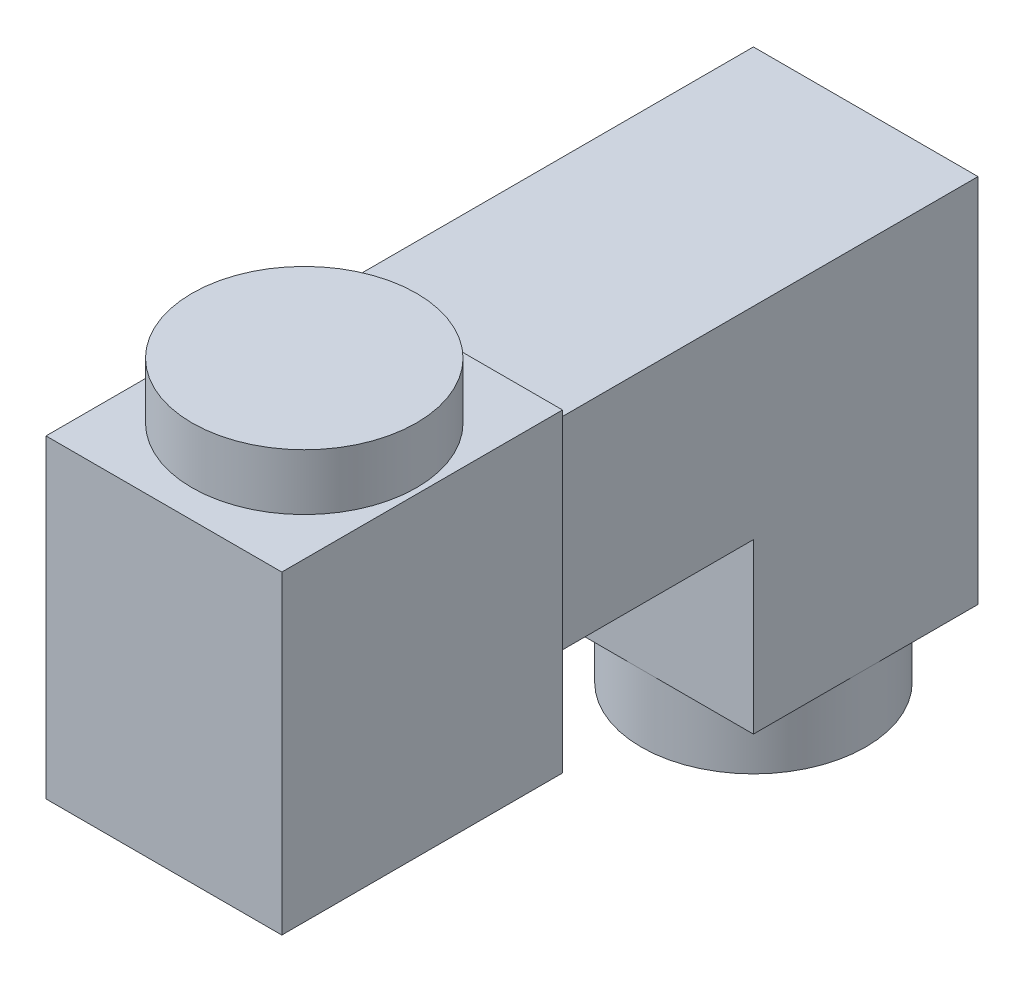
from build123d import *

# Parameters (mm, degrees)
ESQUISSE1_W        = 25
ESQUISSE1_H        = 28
BOSS_EXTRU_1_DEPTH = 21
ESQUISSE2_W        = 20
ESQUISSE2_H        = 18
BOSS_EXTRU_2_DEPTH = 37.5
ESQUISSE3_W        = 20
ESQUISSE3_H        = 20
BOSS_EXTRU_3_DEPTH = 15
ESQUISSE5_R        = 10
BOSS_EXTRU_4_DEPTH = 5
ESQUISSE6_R        = 10
BOSS_EXTRU_5_DEPTH = 6


with BuildPart() as part:
    # Esquisse1 → Boss.-Extru.1 (new body)
    with BuildSketch(Plane(origin=(0, 0, 0), x_dir=(0, 0, -1), z_dir=(1, 0, 0))):
        with Locations((156.893217971, 169.300046999)):
            Rectangle(ESQUISSE1_W, ESQUISSE1_H)
    extrude(amount=BOSS_EXTRU_1_DEPTH)

    # Esquisse2 → Boss.-Extru.2 (add)
    with BuildSketch(Plane(origin=(0, 0, -169.393217971), x_dir=(-1, 0, 0), z_dir=(0, 0, -1))):
        with Locations((-10.5, 173.300046999)):
            Rectangle(ESQUISSE2_W, ESQUISSE2_H)
    extrude(amount=BOSS_EXTRU_2_DEPTH)

    # Esquisse3 → Boss.-Extru.3 (add)
    with BuildSketch(Plane.XZ.offset(-164.300046999)):
        with Locations((10.5, -196.893217971)):
            Rectangle(ESQUISSE3_W, ESQUISSE3_H)
    extrude(amount=BOSS_EXTRU_3_DEPTH)

    # Esquisse5 → Boss.-Extru.4 (add)
    with BuildSketch(Plane(origin=(0, 183.300046999, 0), x_dir=(1, 0, 0), z_dir=(0, 1, 0))):
        with Locations(Location((10.5, 156.893217971, 0), (0, 0, 270))):
            Circle(ESQUISSE5_R)
    extrude(amount=BOSS_EXTRU_4_DEPTH)

    # Esquisse6 → Boss.-Extru.5 (add)
    with BuildSketch(Plane(origin=(0, 149.300046999, 0), x_dir=(-1, 0, 0), z_dir=(0, -1, 0))):
        with Locations(Location((-10.5, 196.893217971, 0), (0, 0, 90))):
            Circle(ESQUISSE6_R)
    extrude(amount=BOSS_EXTRU_5_DEPTH)


solid = part.part
